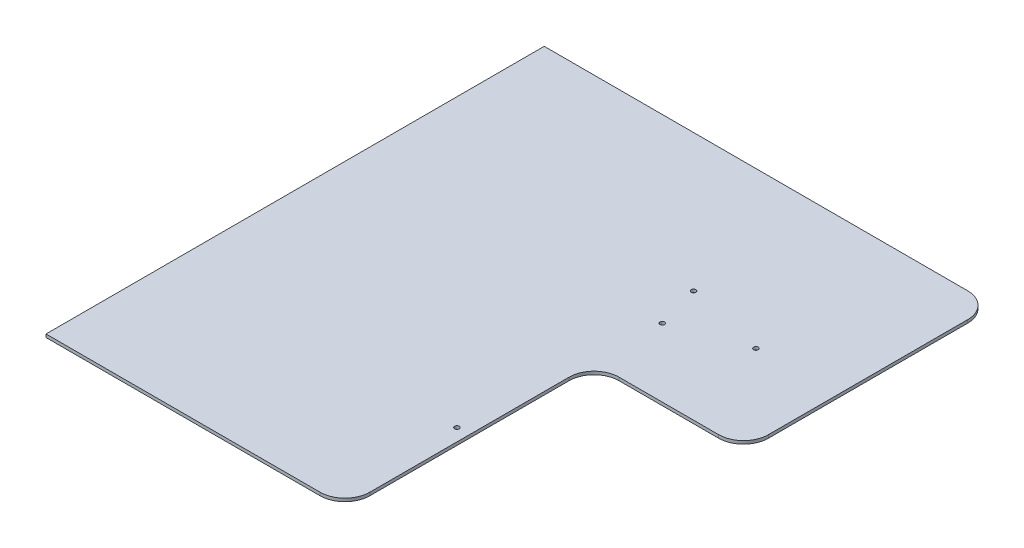
from build123d import *

# Parameters (mm, degrees)
SKETCH1_W           = 304.8
SKETCH1_H           = 508
BOSS_EXTRUDE1_DEPTH = 3.175
SKETCH4_W           = 254.003143871
SKETCH4_H           = 3.175
BOSS_EXTRUDE2_DEPTH = 152.4
FILLET1_R           = 25.4
FILLET2_R           = 25.4
SKETCH2_R           = 2.38125
CUT_EXTRUDE3_DEPTH  = 152.4
FILLET3_R           = 25.4
SKETCH5_R           = 2.38125
CUT_EXTRUDE4_DEPTH  = 397.775399592


with BuildPart() as part:
    # Sketch1 → Boss-Extrude1 (new body)
    with BuildSketch(Plane(origin=(0, 0, 0), x_dir=(1, 0, 0), z_dir=(0, 1, 0))):
        Rectangle(SKETCH1_W, SKETCH1_H)
    extrude(amount=BOSS_EXTRUDE1_DEPTH)

    # Sketch4 → Boss-Extrude2 (add)
    with BuildSketch(Plane(origin=(152.4, 0, 0), x_dir=(0, 0, -1), z_dir=(1, 0, 0))):
        with Locations((127.001571936, 1.5875)):
            Rectangle(SKETCH4_W, SKETCH4_H)
    extrude(amount=BOSS_EXTRUDE2_DEPTH)

    # Fillet1
    fillet1_edges = [part.edges().sort_by_distance(p)[0] for p in [
        (152.4, 1.5875, 0),
    ]]
    fillet(fillet1_edges, radius=FILLET1_R)

    # Fillet2
    fillet2_edges = [part.edges().sort_by_distance(p)[0] for p in [
        (304.8, 1.5875, -254.003143871),
        (304.8, 1.5875, 0),
    ]]
    fillet(fillet2_edges, radius=FILLET2_R)

    # Sketch2 → Cut-Extrude3 (cut)
    with BuildSketch(Plane(origin=(0, 3.175, 0), x_dir=(1, 0, 0), z_dir=(0, 1, 0))):
        with Locations(Location((139.7, -127.172447344, 0), (0, 0, 270))):
            Circle(SKETCH2_R)
        with Locations(Location((139.7, 114.127552656, 0), (0, 0, 270))):
            Circle(SKETCH2_R)
    extrude(amount=-CUT_EXTRUDE3_DEPTH, mode=Mode.SUBTRACT)

    # Fillet3
    fillet3_edges = [part.edges().sort_by_distance(p)[0] for p in [
        (152.4, 1.5875, 254),
    ]]
    fillet(fillet3_edges, radius=FILLET3_R)

    # Sketch5 → Cut-Extrude4 (cut, through all)
    with BuildSketch(Plane(origin=(0, 3.175, 0), x_dir=(1, 0, 0), z_dir=(0, 1, 0))):
        with Locations(Location((152.4, 69.677552656, 0), (0, 0, 270))):
            Circle(SKETCH5_R)
        with Locations(Location((222.25, 95.077552656, 0), (0, 0, 270))):
            Circle(SKETCH5_R)
        with Locations(Location((139.7, 114.127552656, 0), (0, 0, 270))):
            Circle(SKETCH5_R)
    extrude(amount=-CUT_EXTRUDE4_DEPTH, mode=Mode.SUBTRACT)


solid = part.part
